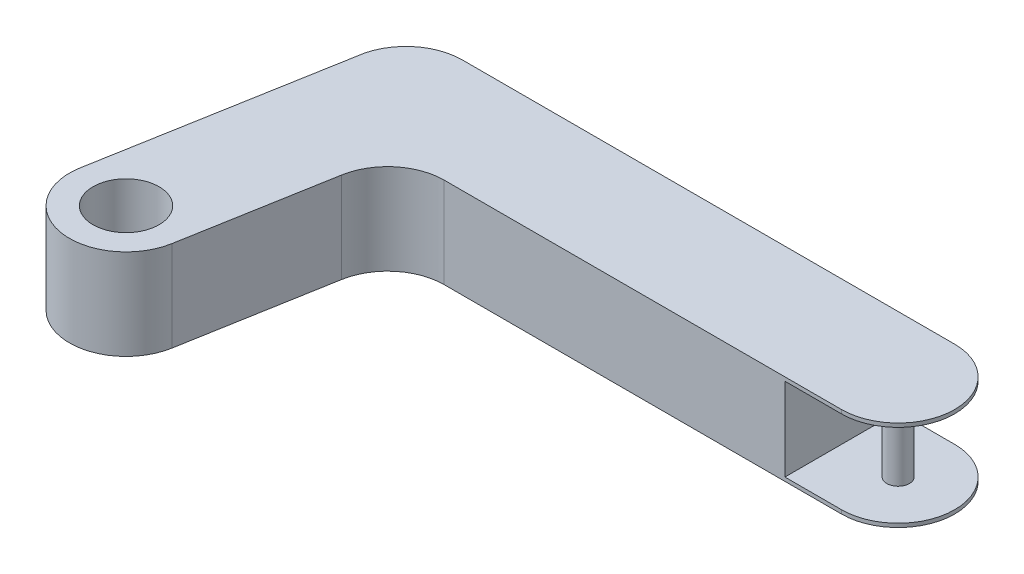
from build123d import *

# Parameters (mm, degrees)
BOSS_EXTRUDE1_DEPTH             = 30.48
BOSS_EXTRUDE1_DEPTH_BACK        = 30.48
SKETCH1_R                       = 22.225
SKETCH1_R_2                     = 7.62
CUT_EXTRUDE2_DEPTH              = 76.2
BOSS_EXTRUDE3_REACH             = 447.466
SKETCH5_R                       = 7.62
BOSS_EXTRUDE3_DIRECTION_2_REACH = 447.466


with BuildPart() as part:
    # Sketch1 → Boss-Extrude1 (new, two sides: drawn at the far end of the back side and taken through both)
    with BuildSketch(Plane(origin=(0, 0, 0), x_dir=(1, 0, 0), z_dir=(0, 1, 0)).offset(-BOSS_EXTRUDE1_DEPTH_BACK)):
        with BuildLine():
            Line((359.662846674, 198.232216379), (28.235630228, 198.232216379))
            ThreePointArc((28.235630228, 198.232216379), (4.898580527, 190.2485261), (-8.658113435, 169.643350826))
            Line((-8.658113435, 169.643350826), (-37.51656391, 6.642095481))
            ThreePointArc((-37.51656391, 6.642095481), (-6.629045926, -37.518871919), (37.52117539, -6.615995569))
            Line((37.52117539, -6.615995569), (54.653846734, 90.548211948))
            ThreePointArc((54.653846734, 90.548211948), (67.684814195, 113.118509662), (92.175022124, 122.032216379))
            Line((92.175022124, 122.032216379), (359.662846674, 122.032216379))
            ThreePointArc((359.662846674, 122.032216379), (397.762846674, 160.132216379), (359.662846674, 198.232216379))
        make_face()
        with Locations(Location((0, 0, 0), (0, 0, 270))):
            Circle(SKETCH1_R, mode=Mode.SUBTRACT)
        with Locations(Location((359.662846674, 160.132216379, 0), (0, 0, 270))):
            Circle(SKETCH1_R_2, mode=Mode.SUBTRACT)
    extrude(amount=BOSS_EXTRUDE1_DEPTH + BOSS_EXTRUDE1_DEPTH_BACK)

    # Sketch4 → Cut-Extrude2 (cut)
    with BuildSketch(Plane(origin=(0, 0, -198.232216379), x_dir=(-1, 0, 0), z_dir=(0, 0, -1))):
        Polygon((-397.762846674, 0), (-397.762846674, 27.94), (-321.562846674, 27.94), (-321.562846674, -27.94), (-397.762846674, -27.94), align=None)
    extrude(amount=-CUT_EXTRUDE2_DEPTH, mode=Mode.SUBTRACT)

    # Boss-Extrude3: up to this face of the body (flat: up to its plane)
    boss_extrude3_end = Plane(part.part.faces().sort_by_distance((144.088603617, 30.48, -132.672626022))[0])
    # Sketch5 → Boss-Extrude3 (add, up to the picked face)
    with BuildSketch(Plane(origin=(0, 0, 0), x_dir=(1, 0, 0), z_dir=(0, 1, 0)), mode=Mode.PRIVATE) as boss_extrude3_sk1:
        with Locations((359.662846674, 160.132216379)):
            Circle(SKETCH5_R)
    boss_extrude3_tool1 = split(extrude(boss_extrude3_sk1.sketch, amount=BOSS_EXTRUDE3_REACH, mode=Mode.PRIVATE), bisect_by=boss_extrude3_end, keep=Keep.BOTH, mode=Mode.PRIVATE)
    add(boss_extrude3_tool1.solids().sort_by(Axis((359.662847, 0, -160.132216), (0, 1, 0)))[0])

    # Boss-Extrude3 direction 2: up to this face of the body (flat: up to its plane)
    boss_extrude3_direction_2_end = Plane(part.part.faces().sort_by_distance((144.088603617, -30.48, -132.672626022))[0])
    # Sketch5 → Boss-Extrude3 direction 2 (add, up to the picked face)
    with BuildSketch(Plane(origin=(0, 0, 0), x_dir=(1, 0, 0), z_dir=(0, 1, 0)), mode=Mode.PRIVATE) as boss_extrude3_direction_2_sk1:
        with Locations((359.662846674, 160.132216379)):
            Circle(SKETCH5_R)
    boss_extrude3_direction_2_tool1 = split(extrude(boss_extrude3_direction_2_sk1.sketch, amount=-BOSS_EXTRUDE3_DIRECTION_2_REACH, mode=Mode.PRIVATE), bisect_by=boss_extrude3_direction_2_end, keep=Keep.BOTH, mode=Mode.PRIVATE)
    add(boss_extrude3_direction_2_tool1.solids().sort_by(Axis((359.662847, 0, -160.132216), (0, -1, 0)))[0])


solid = part.part
